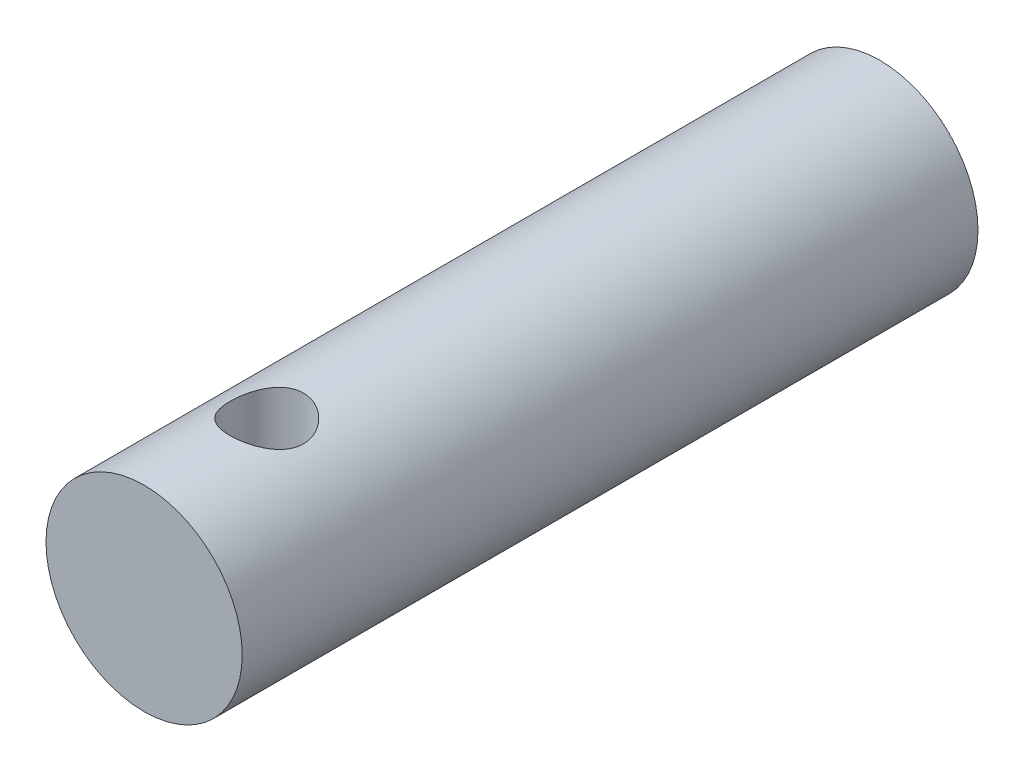
from build123d import *

# Parameters (mm, degrees)
CROQUIS1_R              = 4
SALIENTE_EXTRUIR1_DEPTH = 30
CROQUIS2_R              = 1.5
CORTAR_EXTRUIR1_DEPTH   = 32.304951685


with BuildPart() as part:
    # Croquis1 → Saliente-Extruir1 (new body)
    with BuildSketch(Plane.XY):
        Circle(CROQUIS1_R)
    extrude(amount=SALIENTE_EXTRUIR1_DEPTH)

    # Croquis2 → Cortar-Extruir1 (cut, through all)
    with BuildSketch(Plane(origin=(0, 4, 0), x_dir=(1, 0, 0), z_dir=(0, 1, 0))):
        with Locations(Location((0, -25, 0), (0, 0, 270))):
            Circle(CROQUIS2_R)
    extrude(amount=-CORTAR_EXTRUIR1_DEPTH, mode=Mode.SUBTRACT)


solid = part.part
